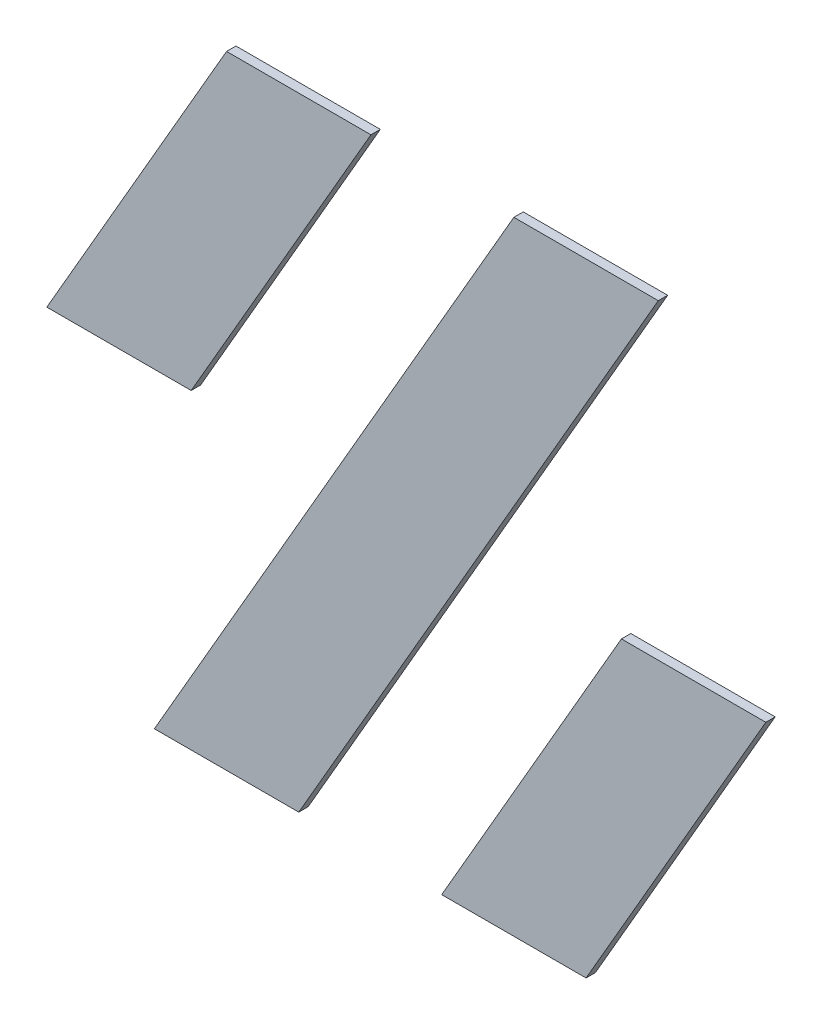
from build123d import *

# Parameters (mm, degrees)
ESTRUSIONE_ESTRUSIONE1_DEPTH   = 0.3
ESTRUSIONE_ESTRUSIONE1_2_DEPTH = 0.3
ESTRUSIONE_ESTRUSIONE1_3_DEPTH = 0.3


with BuildPart() as part:
    # Schizzo1 → Estrusione-Estrusione1 (new body)
    with BuildSketch(Plane.XY):
        Polygon((-1.131197846, 9.959292144), (-6.881197846, 0), (-11.5, 0), (-5.75, 9.959292144), align=None)
    extrude(amount=-ESTRUSIONE_ESTRUSIONE1_DEPTH)


with BuildPart() as body_2:
    # Schizzo1 → Estrusione-Estrusione1 2 (new body)
    with BuildSketch(Plane.XY):
        Polygon((5.75, -9.959292144), (11.5, 0), (6.881197846, 0), (1.131197846, -9.959292144), align=None)
    extrude(amount=-ESTRUSIONE_ESTRUSIONE1_2_DEPTH)


with BuildPart() as body_3:
    # Schizzo1 → Estrusione-Estrusione1 3 (new body)
    with BuildSketch(Plane.XY):
        Polygon((3.441416285, 9.959292144), (8.060218439, 9.959292144), (-3.439781561, -9.959292144), (-8.058583715, -9.959292144), align=None)
    extrude(amount=-ESTRUSIONE_ESTRUSIONE1_3_DEPTH)


solid = Compound([part.part, body_2.part, body_3.part])
